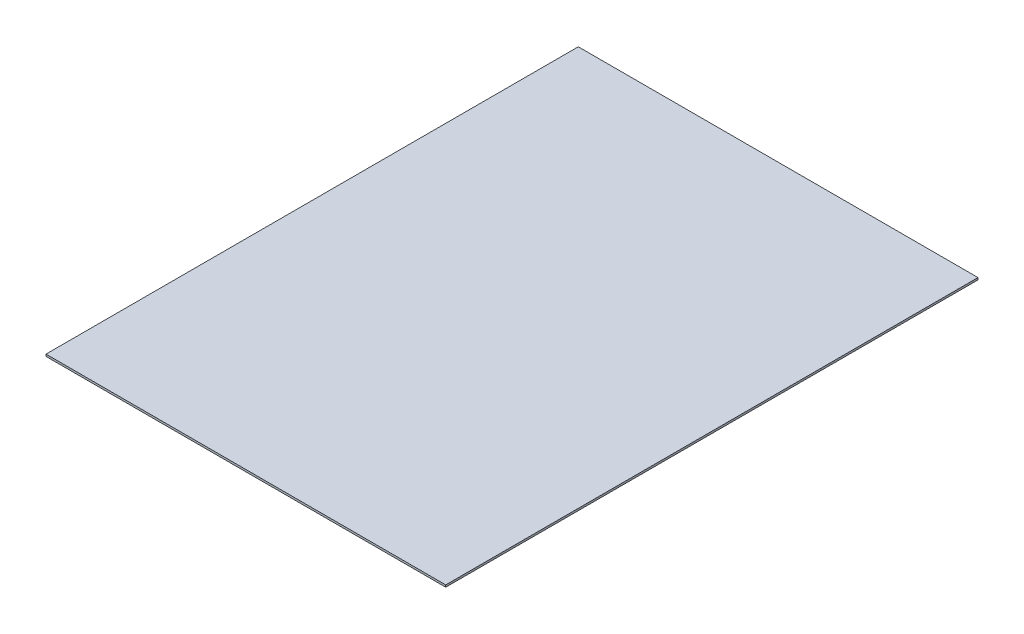
from build123d import *

# Parameters (mm, degrees)
SKETCH1_W           = 622.3
SKETCH1_H           = 828.675
BOSS_EXTRUDE1_DEPTH = 3.175


with BuildPart() as part:
    # Sketch1 → Boss-Extrude1 (new body)
    with BuildSketch(Plane(origin=(0, 0, 0), x_dir=(1, 0, 0), z_dir=(0, 1, 0))):
        with Locations((311.15, 414.3375)):
            Rectangle(SKETCH1_W, SKETCH1_H)
    extrude(amount=BOSS_EXTRUDE1_DEPTH)


solid = part.part
